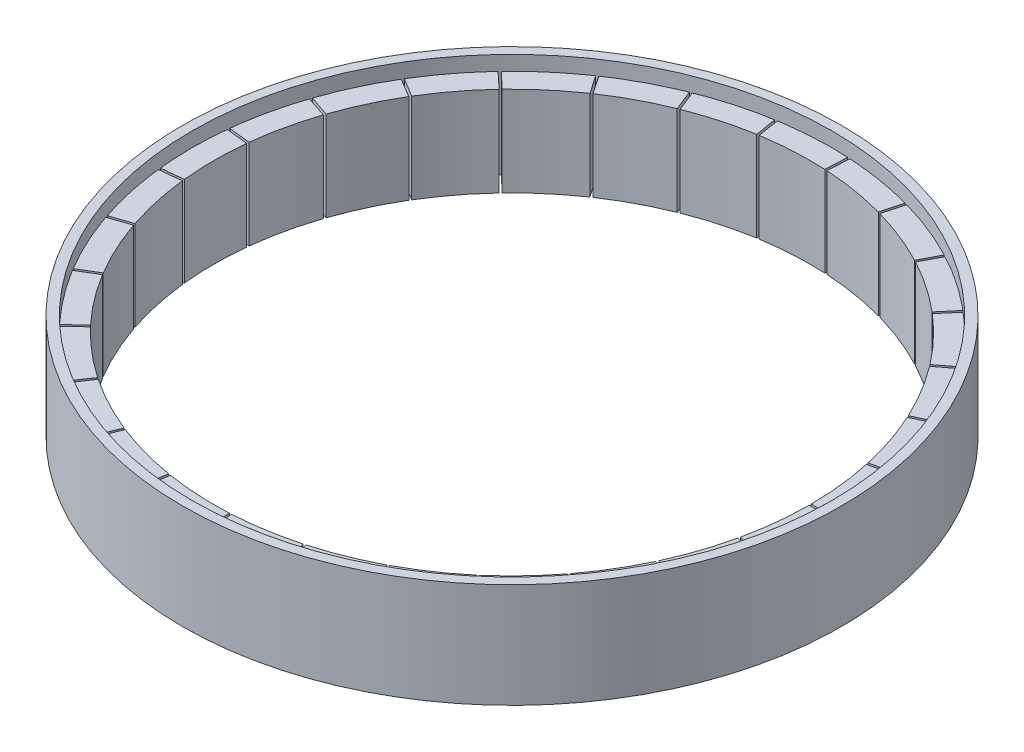
from build123d import *

# Parameters (mm, degrees)
SKETCH1_W         = 1.3
SKETCH1_H         = 14.3
SKETCH2_W         = 3
SKETCH2_H         = 12.3
REVOLVE2_ANGLE    = 12
CIRPATTERN2_COUNT = 29


with BuildPart() as part:
    # Sketch1 → Revolve1 (revolve)
    with BuildSketch(Plane.XY, mode=Mode.PRIVATE) as revolve1_sk:
        with Locations((-44.45, 7.15)):
            Rectangle(SKETCH1_W, SKETCH1_H)
    revolve(revolve1_sk.sketch.rotate(Axis((0, 0, 0), (0, -1, 0)), 270), axis=Axis((0, 0, 0), (0, -1, 0)))


with BuildPart() as body_2:
    # Sketch2 → Revolve2 (revolve, symmetric)
    with BuildSketch(Plane.XY) as revolve2_sk:
        with Locations((-42.3, 6.15)):
            Rectangle(SKETCH2_W, SKETCH2_H)
    revolve(axis=Axis((0, 0, 0), (0, 1, 0)), revolution_arc=REVOLVE2_ANGLE / 2)
    revolve(revolve2_sk.sketch, axis=Axis((0, 0, 0), (0, -1, 0)), revolution_arc=REVOLVE2_ANGLE / 2)


with BuildPart() as cirpattern2_1:
    # CirPattern2: pattern copy
    add(body_2.part.rotate(Axis((0, 0, 0), (0, 1, 0)), 1 * 360 / CIRPATTERN2_COUNT))


with BuildPart() as cirpattern2_2:
    # CirPattern2: pattern copy
    add(body_2.part.rotate(Axis((0, 0, 0), (0, 1, 0)), 2 * 360 / CIRPATTERN2_COUNT))


with BuildPart() as cirpattern2_3:
    # CirPattern2: pattern copy
    add(body_2.part.rotate(Axis((0, 0, 0), (0, 1, 0)), 3 * 360 / CIRPATTERN2_COUNT))


with BuildPart() as cirpattern2_4:
    # CirPattern2: pattern copy
    add(body_2.part.rotate(Axis((0, 0, 0), (0, 1, 0)), 4 * 360 / CIRPATTERN2_COUNT))


with BuildPart() as cirpattern2_5:
    # CirPattern2: pattern copy
    add(body_2.part.rotate(Axis((0, 0, 0), (0, 1, 0)), 5 * 360 / CIRPATTERN2_COUNT))


with BuildPart() as cirpattern2_6:
    # CirPattern2: pattern copy
    add(body_2.part.rotate(Axis((0, 0, 0), (0, 1, 0)), 6 * 360 / CIRPATTERN2_COUNT))


with BuildPart() as cirpattern2_7:
    # CirPattern2: pattern copy
    add(body_2.part.rotate(Axis((0, 0, 0), (0, 1, 0)), 7 * 360 / CIRPATTERN2_COUNT))


with BuildPart() as cirpattern2_8:
    # CirPattern2: pattern copy
    add(body_2.part.rotate(Axis((0, 0, 0), (0, 1, 0)), 8 * 360 / CIRPATTERN2_COUNT))


with BuildPart() as cirpattern2_9:
    # CirPattern2: pattern copy
    add(body_2.part.rotate(Axis((0, 0, 0), (0, 1, 0)), 9 * 360 / CIRPATTERN2_COUNT))


with BuildPart() as cirpattern2_10:
    # CirPattern2: pattern copy
    add(body_2.part.rotate(Axis((0, 0, 0), (0, 1, 0)), 10 * 360 / CIRPATTERN2_COUNT))


with BuildPart() as cirpattern2_11:
    # CirPattern2: pattern copy
    add(body_2.part.rotate(Axis((0, 0, 0), (0, 1, 0)), 11 * 360 / CIRPATTERN2_COUNT))


with BuildPart() as cirpattern2_12:
    # CirPattern2: pattern copy
    add(body_2.part.rotate(Axis((0, 0, 0), (0, 1, 0)), 12 * 360 / CIRPATTERN2_COUNT))


with BuildPart() as cirpattern2_13:
    # CirPattern2: pattern copy
    add(body_2.part.rotate(Axis((0, 0, 0), (0, 1, 0)), 13 * 360 / CIRPATTERN2_COUNT))


with BuildPart() as cirpattern2_14:
    # CirPattern2: pattern copy
    add(body_2.part.rotate(Axis((0, 0, 0), (0, 1, 0)), 14 * 360 / CIRPATTERN2_COUNT))


with BuildPart() as cirpattern2_15:
    # CirPattern2: pattern copy
    add(body_2.part.rotate(Axis((0, 0, 0), (0, 1, 0)), 15 * 360 / CIRPATTERN2_COUNT))


with BuildPart() as cirpattern2_16:
    # CirPattern2: pattern copy
    add(body_2.part.rotate(Axis((0, 0, 0), (0, 1, 0)), 16 * 360 / CIRPATTERN2_COUNT))


with BuildPart() as cirpattern2_17:
    # CirPattern2: pattern copy
    add(body_2.part.rotate(Axis((0, 0, 0), (0, 1, 0)), 17 * 360 / CIRPATTERN2_COUNT))


with BuildPart() as cirpattern2_18:
    # CirPattern2: pattern copy
    add(body_2.part.rotate(Axis((0, 0, 0), (0, 1, 0)), 18 * 360 / CIRPATTERN2_COUNT))


with BuildPart() as cirpattern2_19:
    # CirPattern2: pattern copy
    add(body_2.part.rotate(Axis((0, 0, 0), (0, 1, 0)), 19 * 360 / CIRPATTERN2_COUNT))


with BuildPart() as cirpattern2_20:
    # CirPattern2: pattern copy
    add(body_2.part.rotate(Axis((0, 0, 0), (0, 1, 0)), 20 * 360 / CIRPATTERN2_COUNT))


with BuildPart() as cirpattern2_21:
    # CirPattern2: pattern copy
    add(body_2.part.rotate(Axis((0, 0, 0), (0, 1, 0)), 21 * 360 / CIRPATTERN2_COUNT))


with BuildPart() as cirpattern2_22:
    # CirPattern2: pattern copy
    add(body_2.part.rotate(Axis((0, 0, 0), (0, 1, 0)), 22 * 360 / CIRPATTERN2_COUNT))


with BuildPart() as cirpattern2_23:
    # CirPattern2: pattern copy
    add(body_2.part.rotate(Axis((0, 0, 0), (0, 1, 0)), 23 * 360 / CIRPATTERN2_COUNT))


with BuildPart() as cirpattern2_24:
    # CirPattern2: pattern copy
    add(body_2.part.rotate(Axis((0, 0, 0), (0, 1, 0)), 24 * 360 / CIRPATTERN2_COUNT))


with BuildPart() as cirpattern2_25:
    # CirPattern2: pattern copy
    add(body_2.part.rotate(Axis((0, 0, 0), (0, 1, 0)), 25 * 360 / CIRPATTERN2_COUNT))


with BuildPart() as cirpattern2_26:
    # CirPattern2: pattern copy
    add(body_2.part.rotate(Axis((0, 0, 0), (0, 1, 0)), 26 * 360 / CIRPATTERN2_COUNT))


with BuildPart() as cirpattern2_27:
    # CirPattern2: pattern copy
    add(body_2.part.rotate(Axis((0, 0, 0), (0, 1, 0)), 27 * 360 / CIRPATTERN2_COUNT))


with BuildPart() as cirpattern2_28:
    # CirPattern2: pattern copy
    add(body_2.part.rotate(Axis((0, 0, 0), (0, 1, 0)), 28 * 360 / CIRPATTERN2_COUNT))


solid = Compound([part.part, body_2.part, cirpattern2_1.part, cirpattern2_2.part, cirpattern2_3.part, cirpattern2_4.part, cirpattern2_5.part, cirpattern2_6.part, cirpattern2_7.part, cirpattern2_8.part, cirpattern2_9.part, cirpattern2_10.part, cirpattern2_11.part, cirpattern2_12.part, cirpattern2_13.part, cirpattern2_14.part, cirpattern2_15.part, cirpattern2_16.part, cirpattern2_17.part, cirpattern2_18.part, cirpattern2_19.part, cirpattern2_20.part, cirpattern2_21.part, cirpattern2_22.part, cirpattern2_23.part, cirpattern2_24.part, cirpattern2_25.part, cirpattern2_26.part, cirpattern2_27.part, cirpattern2_28.part])
